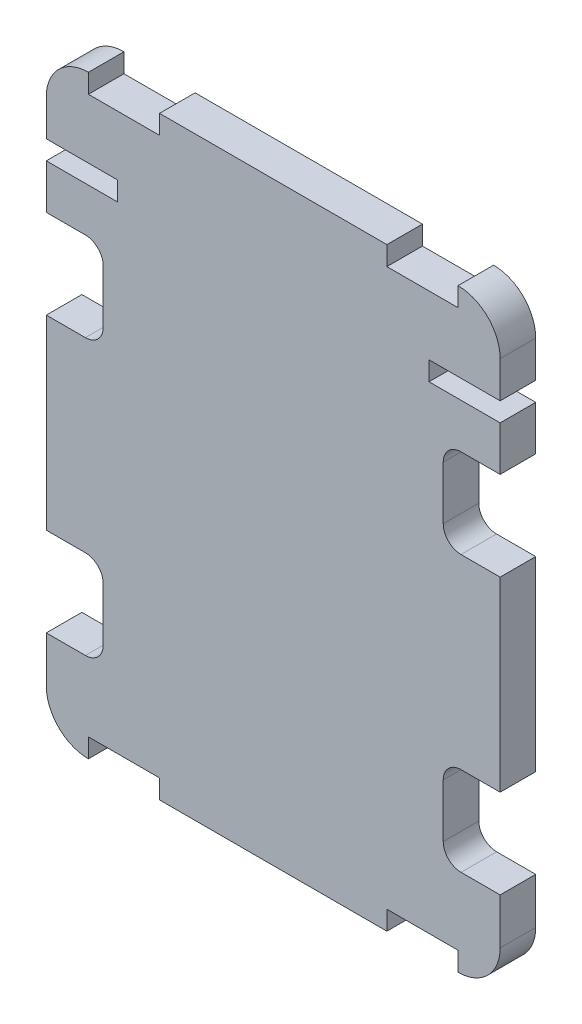
from build123d import *

# Parameters (mm, degrees)
BOSS_EXTRUDE1_DEPTH = 6.35


with BuildPart() as part:
    # Sketch1 → Boss-Extrude1 (new body)
    with BuildSketch(Plane.XY):
        with BuildLine():
            Line((8662.207393671, 3006.696553149), (8662.207393671, 3000.166824887))
            Line((8662.207393671, 3000.166824887), (8649.507393671, 3000.166824887))
            Line((8649.507393671, 3000.166824887), (8649.507393671, 2996.763224887))
            Line((8649.507393671, 2996.763224887), (8662.207393671, 2996.763224887))
            Line((8662.207393671, 2996.763224887), (8662.207393671, 2988.787624887))
            Line((8662.207393671, 2988.787624887), (8655.222393671, 2988.787624887))
            ThreePointArc((8655.222393671, 2988.787624887), (8652.977329641, 2987.857688918), (8652.047393671, 2985.612624887))
            Line((8652.047393671, 2985.612624887), (8652.047393671, 2976.087624887))
            ThreePointArc((8652.047393671, 2976.087624887), (8652.977329641, 2973.842560857), (8655.222393671, 2972.912624887))
            Line((8655.222393671, 2972.912624887), (8662.207393671, 2972.912624887))
            Line((8662.207393671, 2972.912624887), (8662.207393671, 2939.653253149))
            Line((8662.207393671, 2939.653253149), (8655.222393671, 2939.653253149))
            ThreePointArc((8655.222393671, 2939.653253149), (8652.977329641, 2938.723317179), (8652.047393671, 2936.478253149))
            Line((8652.047393671, 2936.478253149), (8652.047393671, 2926.953253149))
            ThreePointArc((8652.047393671, 2926.953253149), (8652.977329641, 2924.708189118), (8655.222393671, 2923.778253149))
            Line((8655.222393671, 2923.778253149), (8662.207393671, 2923.778253149))
            Line((8662.207393671, 2923.778253149), (8662.207393671, 2915.574053149))
            ThreePointArc((8662.207393671, 2915.574053149), (8660.005305295, 2910.257741525), (8654.688993671, 2908.055653149))
            Line((8654.688993671, 2908.055653149), (8654.688993671, 2911.459253149))
            Line((8654.688993671, 2911.459253149), (8641.988993671, 2911.459253149))
            Line((8641.988993671, 2911.459253149), (8641.988993671, 2908.055653149))
            Line((8641.988993671, 2908.055653149), (8601.399793671, 2908.055653149))
            Line((8601.399793671, 2908.055653149), (8601.399793671, 2911.459253149))
            Line((8601.399793671, 2911.459253149), (8588.699793671, 2911.459253149))
            Line((8588.699793671, 2911.459253149), (8588.699793671, 2908.055653149))
            ThreePointArc((8588.699793671, 2908.055653149), (8583.383482047, 2910.257741525), (8581.181393671, 2915.574053149))
            Line((8581.181393671, 2915.574053149), (8581.181393671, 2923.778253149))
            Line((8581.181393671, 2923.778253149), (8588.166393671, 2923.778253149))
            ThreePointArc((8588.166393671, 2923.778253149), (8590.411457701, 2924.708189118), (8591.341393671, 2926.953253149))
            Line((8591.341393671, 2926.953253149), (8591.341393671, 2936.478253149))
            ThreePointArc((8591.341393671, 2936.478253149), (8590.411457701, 2938.723317179), (8588.166393671, 2939.653253149))
            Line((8588.166393671, 2939.653253149), (8581.181393671, 2939.653253149))
            Line((8581.181393671, 2939.653253149), (8581.181393671, 2972.912624887))
            Line((8581.181393671, 2972.912624887), (8588.166393671, 2972.912624887))
            ThreePointArc((8588.166393671, 2972.912624887), (8590.411457701, 2973.842560857), (8591.341393671, 2976.087624887))
            Line((8591.341393671, 2976.087624887), (8591.341393671, 2985.612624887))
            ThreePointArc((8591.341393671, 2985.612624887), (8590.411457701, 2987.857688918), (8588.166393671, 2988.787624887))
            Line((8588.166393671, 2988.787624887), (8581.181393671, 2988.787624887))
            Line((8581.181393671, 2988.787624887), (8581.181393671, 2996.763224887))
            Line((8581.181393671, 2996.763224887), (8593.881393671, 2996.763224887))
            Line((8593.881393671, 2996.763224887), (8593.881393671, 3000.166824887))
            Line((8593.881393671, 3000.166824887), (8581.181393671, 3000.166824887))
            Line((8581.181393671, 3000.166824887), (8581.181393671, 3006.696553149))
            ThreePointArc((8581.181393671, 3006.696553149), (8583.383482047, 3012.012864772), (8588.699793671, 3014.214953149))
            Line((8588.699793671, 3014.214953149), (8588.699793671, 3010.811353149))
            Line((8588.699793671, 3010.811353149), (8601.399793671, 3010.811353149))
            Line((8601.399793671, 3010.811353149), (8601.399793671, 3014.214953149))
            Line((8601.399793671, 3014.214953149), (8641.988993671, 3014.214953149))
            Line((8641.988993671, 3014.214953149), (8641.988993671, 3010.811353149))
            Line((8641.988993671, 3010.811353149), (8654.688993671, 3010.811353149))
            Line((8654.688993671, 3010.811353149), (8654.688993671, 3014.214953149))
            ThreePointArc((8654.688993671, 3014.214953149), (8660.005305295, 3012.012864772), (8662.207393671, 3006.696553149))
        make_face()
    extrude(amount=BOSS_EXTRUDE1_DEPTH)


solid = part.part
